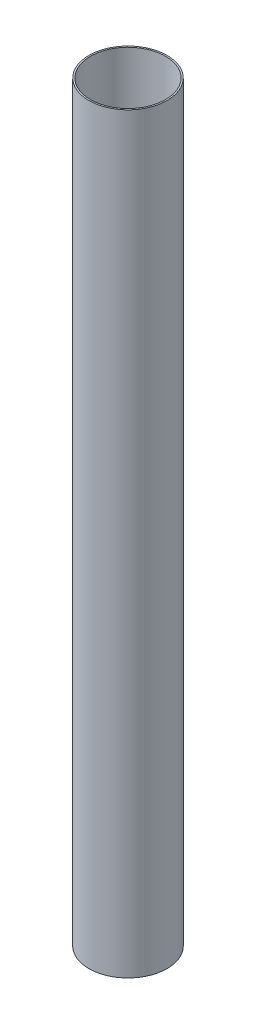
from build123d import *

# Parameters (mm, degrees)
SKETCH1_R           = 39.624
SKETCH1_R_2         = 38.1
BOSS_EXTRUDE1_DEPTH = 762


with BuildPart() as part:
    # Sketch1 → Boss-Extrude1 (new body)
    with BuildSketch(Plane(origin=(0, 0, 0), x_dir=(1, 0, 0), z_dir=(0, 1, 0))):
        with Locations(Location((0, 0, 0), (0, 0, 270))):
            Circle(SKETCH1_R)
        with Locations(Location((0, 0, 0), (0, 0, 270))):
            Circle(SKETCH1_R_2, mode=Mode.SUBTRACT)
    extrude(amount=BOSS_EXTRUDE1_DEPTH)


solid = part.part
